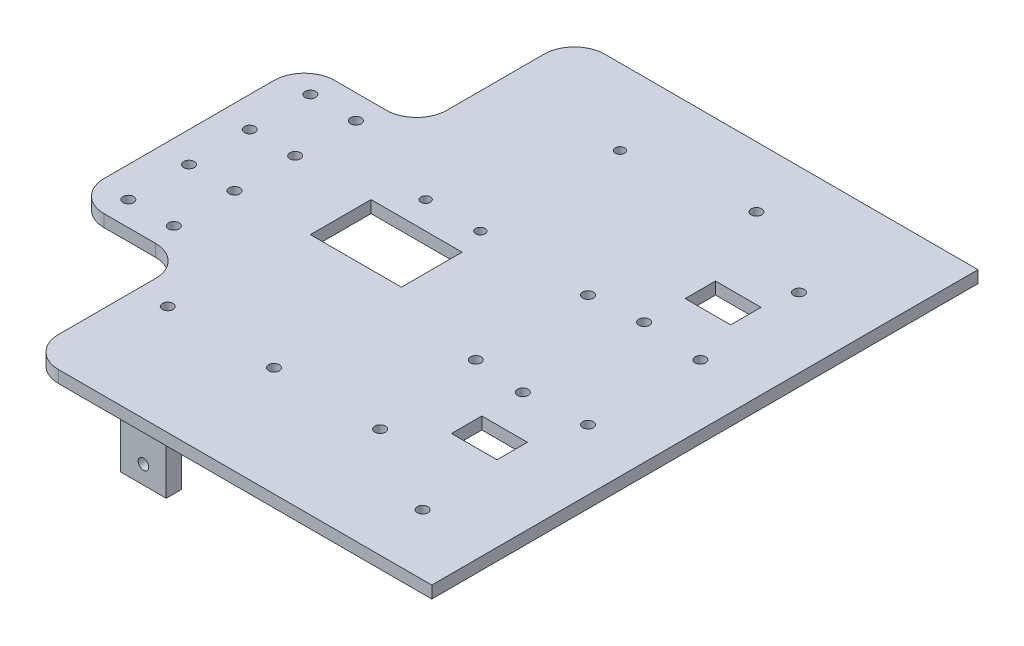
from build123d import *

# Parameters (mm, degrees)
SKETCH1_W               = 300
SKETCH1_H               = 180
MAIN_BODY_DEPTH         = 4
FILLET1_R               = 10
CHAMFER1_SIZE           = 10
SKETCH2_R               = 1.75
BATTERIES_HOLES_DEPTH   = 15
SKETCH5_R               = 1.75
SKETCH5_W               = 15
SKETCH5_H               = 10
L298N_HOLES_DEPTH       = 15
SKETCH6_R               = 1.75
LM2596_HOLES_DEPTH      = 15
SKETCH7_R               = 1.55
ESP32_HOLES_DEPTH       = 15
SKETCH8_R               = 1.75
PCB_SENSORS_HOLES_DEPTH = 15
SKETCH9_W               = 15
SKETCH9_H               = 5
WHEELS_LEGS_DEPTH       = 30
SKETCH10_R              = 1.75
MOTOR_HOLES_DEPTH       = 300
SKETCH11_R              = 1.75
SKETCH11_W              = 30
SKETCH11_H              = 20
SENSORS_HOLES_DEPTH     = 15
SKETCH13_W              = 40
SKETCH13_H              = 75
CUT_EXTRUDE2_DEPTH      = 10
FILLET2_R               = 10
SKETCH12_R              = 1.75
CUT_EXTRUDE3_DEPTH      = 10
SKETCH14_W              = 219.25277831
SKETCH14_H              = 99.771872263
CUT_EXTRUDE4_DEPTH      = 200


with BuildPart() as part:
    # Sketch1 → Main Body (new body)
    with BuildSketch(Plane(origin=(0, 0, 0), x_dir=(1, 0, 0), z_dir=(0, 1, 0))):
        Rectangle(SKETCH1_W, SKETCH1_H)
    extrude(amount=MAIN_BODY_DEPTH)

    # Fillet1
    fillet1_edges = [part.edges().sort_by_distance(p)[0] for p in [
        (-150, 2, 90),
        (-150, 2, -90),
    ]]
    fillet(fillet1_edges, radius=FILLET1_R)

    # Chamfer1
    chamfer1_edges = [part.edges().sort_by_distance(p)[0] for p in [
        (150, 2, 90),
        (150, 2, -90),
    ]]
    chamfer(chamfer1_edges, length=CHAMFER1_SIZE)

    # Sketch2 → Batteries holes (cut)
    with BuildSketch(Plane(origin=(0, 4, 0), x_dir=(1, 0, 0), z_dir=(0, 1, 0))):
        with Locations((115, 75)):
            Circle(SKETCH2_R)
        with Locations((115, 14)):
            Circle(SKETCH2_R)
        with Locations((115, -14)):
            Circle(SKETCH2_R)
        with Locations((115, -75)):
            Circle(SKETCH2_R)
        with Locations((45, -75)):
            Circle(SKETCH2_R)
        with Locations((45, -14)):
            Circle(SKETCH2_R)
        with Locations((45, 14)):
            Circle(SKETCH2_R)
        with Locations((45, 75)):
            Circle(SKETCH2_R)
    extrude(amount=-BATTERIES_HOLES_DEPTH, mode=Mode.SUBTRACT)

    # Sketch5 → L298N holes (cut)
    with BuildSketch(Plane(origin=(0, 4, 0), x_dir=(1, 0, 0), z_dir=(0, 1, 0))):
        with Locations((-37, 18.5)):
            Circle(SKETCH5_R)
        with Locations((0, 18.5)):
            Circle(SKETCH5_R)
        with Locations((-37, -18.5)):
            Circle(SKETCH5_R)
        with Locations((0, -18.5)):
            Circle(SKETCH5_R)
        with Locations((-12.5, -38.5)):
            Rectangle(SKETCH5_W, SKETCH5_H)
        with Locations((-12.5, 38.5)):
            Rectangle(SKETCH5_W, SKETCH5_H)
    extrude(amount=-L298N_HOLES_DEPTH, mode=Mode.SUBTRACT)

    # Sketch6 → LM2596 holes (cut)
    with BuildSketch(Plane(origin=(0, 4, 0), x_dir=(1, 0, 0), z_dir=(0, 1, 0))):
        with Locations((-33, 70)):
            Circle(SKETCH6_R)
        with Locations((-3, 54)):
            Circle(SKETCH6_R)
        with Locations((-33, -54)):
            Circle(SKETCH6_R)
        with Locations((-3, -70)):
            Circle(SKETCH6_R)
    extrude(amount=-LM2596_HOLES_DEPTH, mode=Mode.SUBTRACT)

    # Sketch7 → ESP32 holes (cut)
    with BuildSketch(Plane(origin=(0, 4, 0), x_dir=(1, 0, 0), z_dir=(0, 1, 0))):
        with Locations((-73, 65)):
            Circle(SKETCH7_R)
        with Locations((-73, 19)):
            Circle(SKETCH7_R)
        with Locations((-91, 19)):
            Circle(SKETCH7_R)
    extrude(amount=-ESP32_HOLES_DEPTH, mode=Mode.SUBTRACT)

    # Sketch8 → PCB sensors holes (cut)
    with BuildSketch(Plane(origin=(0, 4, 0), x_dir=(1, 0, 0), z_dir=(0, 1, 0))):
        with Locations((-103, -54)):
            Circle(SKETCH8_R)
        with Locations((-68, -54)):
            Circle(SKETCH8_R)
    extrude(amount=-PCB_SENSORS_HOLES_DEPTH, mode=Mode.SUBTRACT)

    # Sketch9 → Wheels legs (add)
    with BuildSketch(Plane.XZ):
        with Locations((-90, 72.5)):
            Rectangle(SKETCH9_W, SKETCH9_H)
        with Locations((90, 72.5)):
            Rectangle(SKETCH9_W, SKETCH9_H)
        with Locations((90, -72.5)):
            Rectangle(SKETCH9_W, SKETCH9_H)
        with Locations((-90, -72.5)):
            Rectangle(SKETCH9_W, SKETCH9_H)
    extrude(amount=WHEELS_LEGS_DEPTH)

    # Sketch10 → Motor holes (cut)
    with BuildSketch(Plane.XY.offset(75)):
        with Locations((-90, -24)):
            Circle(SKETCH10_R)
        with Locations((-90, -6)):
            Circle(SKETCH10_R)
        with Locations((90, -6)):
            Circle(SKETCH10_R)
        with Locations((90, -24)):
            Circle(SKETCH10_R)
    extrude(amount=-MOTOR_HOLES_DEPTH, mode=Mode.SUBTRACT)

    # Sketch11 → Sensors holes (cut)
    with BuildSketch(Plane(origin=(0, 4, 0), x_dir=(1, 0, 0), z_dir=(0, 1, 0))):
        with Locations((-140, 10)):
            Circle(SKETCH11_R)
        with Locations((-125, 10)):
            Circle(SKETCH11_R)
        with Locations((-125, 30)):
            Circle(SKETCH11_R)
        with Locations((-140, 30)):
            Circle(SKETCH11_R)
        with Locations((-125, -30)):
            Circle(SKETCH11_R)
        with Locations((-140, -30)):
            Circle(SKETCH11_R)
        with Locations((-125, -10)):
            Circle(SKETCH11_R)
        with Locations((-140, -10)):
            Circle(SKETCH11_R)
        with Locations((-85, 0)):
            Rectangle(SKETCH11_W, SKETCH11_H)
    extrude(amount=-SENSORS_HOLES_DEPTH, mode=Mode.SUBTRACT)

    # Sketch13 → Cut-Extrude2 (cut)
    with BuildSketch(Plane.XZ):
        with Locations((-133, 75.5)):
            Rectangle(SKETCH13_W, SKETCH13_H)
        with Locations((-133, -75.5)):
            Rectangle(SKETCH13_W, SKETCH13_H)
    extrude(amount=-CUT_EXTRUDE2_DEPTH, mode=Mode.SUBTRACT)

    # Fillet2
    fillet2_edges = [part.edges().sort_by_distance(p)[0] for p in [
        (-113, 2, -90),
        (-113, 2, -38),
        (-150, 2, -38),
        (-150, 2, 38),
        (-113, 2, 90),
        (-113, 2, 38),
    ]]
    fillet(fillet2_edges, radius=FILLET2_R)

    # Sketch12 → Cut-Extrude3 (cut)
    with BuildSketch(Plane(origin=(0, 4, 0), x_dir=(1, 0, 0), z_dir=(0, 1, 0))):
        with Locations((80, 20)):
            Circle(SKETCH12_R)
        with Locations((80, -20)):
            Circle(SKETCH12_R)
        with Locations((-20, -20)):
            Circle(SKETCH12_R)
        with Locations((-20, 20)):
            Circle(SKETCH12_R)
    extrude(amount=-CUT_EXTRUDE3_DEPTH, mode=Mode.SUBTRACT)

    # Sketch14 → Cut-Extrude4 (cut)
    with BuildSketch(Plane.ZY.offset(-20)):
        with Locations((0.286230781, -6.766483263)):
            Rectangle(SKETCH14_W, SKETCH14_H)
    extrude(amount=-CUT_EXTRUDE4_DEPTH, mode=Mode.SUBTRACT)


solid = part.part
